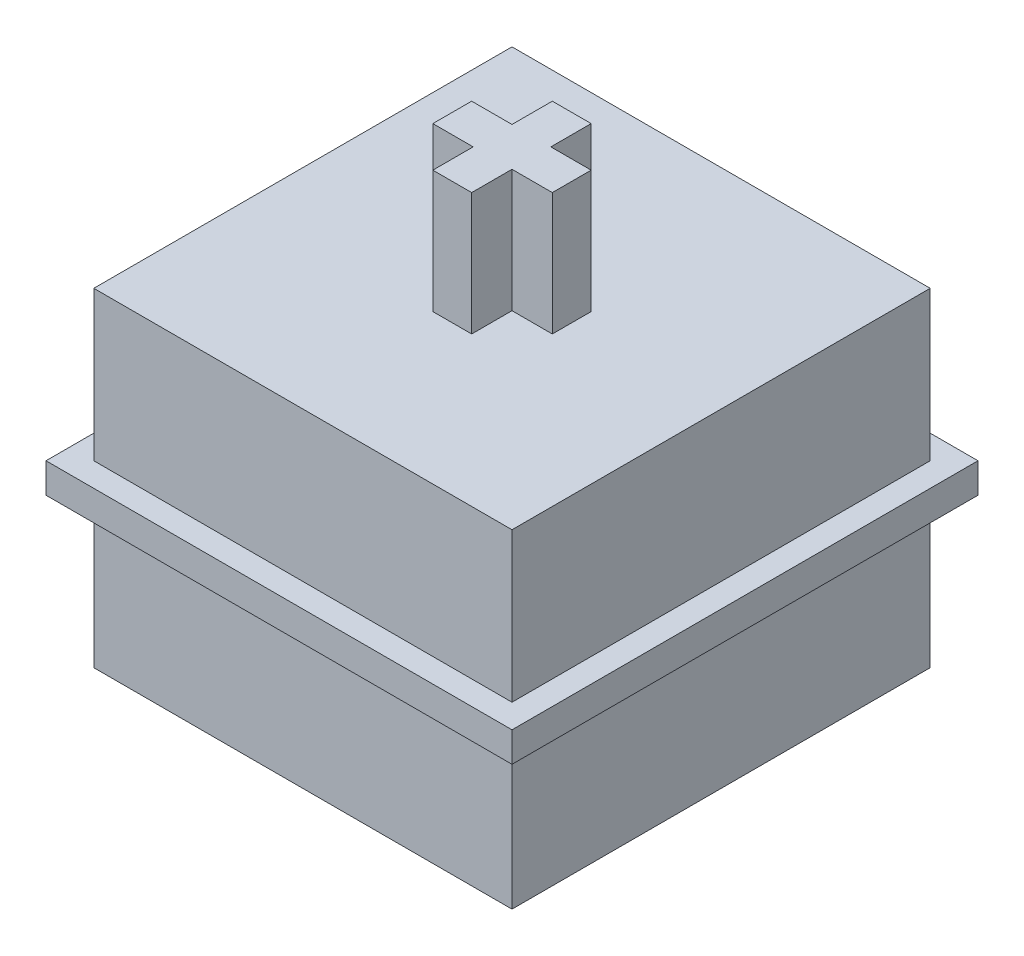
from build123d import *

# Parameters (mm, degrees)
SKETCH_1_W      = 14
SKETCH_1_H      = 14
EXTRUDE_1_DEPTH = 5
SKETCH_2_R      = 1.925
EXTRUDE_2_DEPTH = 2.8
CHAMFER_1_SIZE  = 0.5
SKETCH_3_W      = 15.6
SKETCH_3_H      = 15.6
EXTRUDE_3_DEPTH = 1
SKETCH_4_W      = 14
SKETCH_4_H      = 14
EXTRUDE_4_DEPTH = 5
EXTRUDE_5_DEPTH = 4.1


with BuildPart() as part:
    # 草图1 → 凸台-拉伸1 (new body)
    with BuildSketch(Plane(origin=(0, 0, 0), x_dir=(1, 0, 0), z_dir=(0, 1, 0))):
        with Locations((-2.892561983, 2.024793388)):
            Rectangle(SKETCH_1_W, SKETCH_1_H)
    extrude(amount=EXTRUDE_1_DEPTH)

    # 草图2 → 凸台-拉伸2 (add)
    with BuildSketch(Plane.XZ):
        with Locations(Location((-2.892561983, -2.024793388, 0), (0, 0, 270))):
            Circle(SKETCH_2_R)
    extrude(amount=EXTRUDE_2_DEPTH)

    # 倒角1
    chamfer_1_edges = [part.edges().sort_by_distance(p)[0] for p in [
        (-2.892561983, -2.8, -0.099793388),
    ]]
    chamfer(chamfer_1_edges, length=CHAMFER_1_SIZE)

    # 草图3 → 凸台-拉伸3 (add)
    with BuildSketch(Plane(origin=(0, 5, 0), x_dir=(1, 0, 0), z_dir=(0, 1, 0))):
        with Locations((-2.892561983, 2.024793388)):
            Rectangle(SKETCH_3_W, SKETCH_3_H)
    extrude(amount=EXTRUDE_3_DEPTH)

    # 草图4 → 凸台-拉伸4 (add)
    with BuildSketch(Plane(origin=(0, 6, 0), x_dir=(1, 0, 0), z_dir=(0, 1, 0))):
        with Locations((-2.892561983, 2.024793388)):
            Rectangle(SKETCH_4_W, SKETCH_4_H)
    extrude(amount=EXTRUDE_4_DEPTH)

    # 草图5 → 凸台-拉伸5 (add)
    with BuildSketch(Plane(origin=(0, 11, 0), x_dir=(1, 0, 0), z_dir=(0, 1, 0))):
        Polygon((-3.542561983, 2.674793388), (-3.542561983, 4.024793388), (-2.242561983, 4.024793388), (-2.242561983, 2.674793388), (-0.892561983, 2.674793388), (-0.892561983, 1.374793388), (-2.242561983, 1.374793388), (-2.242561983, 0.024793388), (-3.542561983, 0.024793388), (-3.542561983, 1.374793388), (-4.892561983, 1.374793388), (-4.892561983, 2.674793388), align=None)
    extrude(amount=EXTRUDE_5_DEPTH)


solid = part.part
